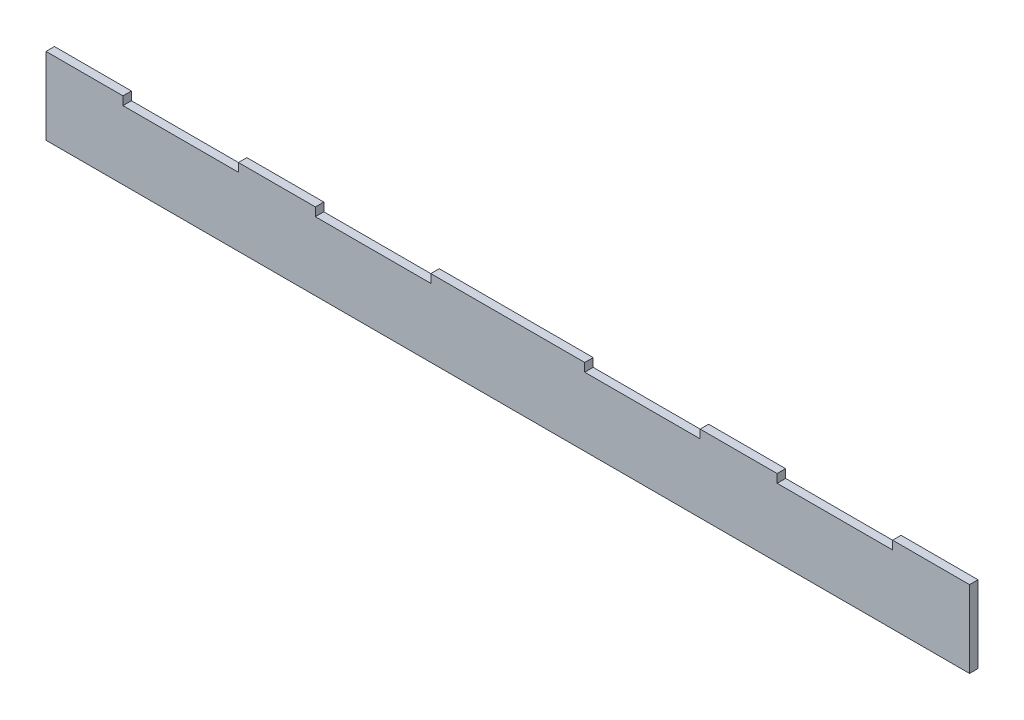
from build123d import *

# Parameters (mm, degrees)
BOSS_EXTRUDE2_DEPTH = 5.588


with BuildPart() as part:
    # Sketch1 → Boss-Extrude2 (new body)
    with BuildSketch(Plane.XY):
        Polygon((-158.244247788, 18.207079646), (-107.444247788, 18.207079646), (-107.444247788, 12.619079646), (-31.244247788, 12.619079646), (-31.244247788, 18.207079646), (19.555752212, 18.207079646), (19.555752212, 12.619079646), (95.755752212, 12.619079646), (95.755752212, 18.207079646), (197.355752212, 18.207079646), (197.355752212, 12.619079646), (273.555752212, 12.619079646), (273.555752212, 18.207079646), (324.355752212, 18.207079646), (324.355752212, 12.619079646), (400.555752212, 12.619079646), (400.555752212, 18.207079646), (451.355752212, 18.207079646), (451.355752212, -32.592920354), (-158.244247788, -32.592920354), align=None)
    extrude(amount=BOSS_EXTRUDE2_DEPTH)


solid = part.part
